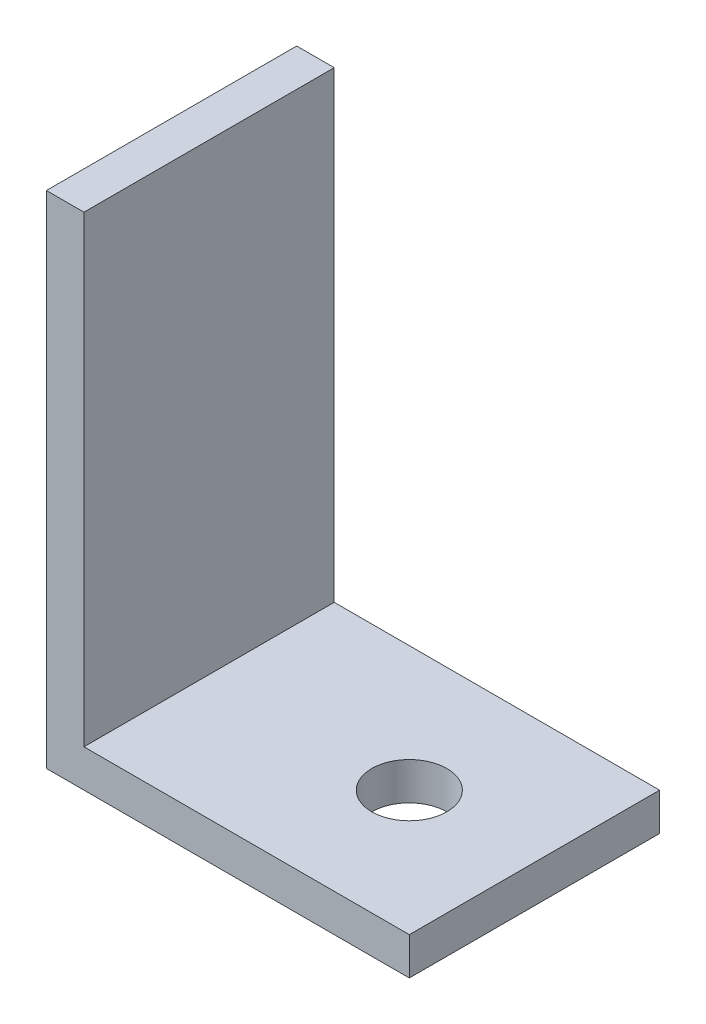
from build123d import *

# Parameters (mm, degrees)
BOSS_EXTRUDE1_DEPTH = 20
SKETCH2_R           = 3
CUT_EXTRUDE1_DEPTH  = 52.088159098


with BuildPart() as part:
    # Sketch1 → Boss-Extrude1 (new body)
    with BuildSketch(Plane.XY):
        Polygon((0, 0), (0, 40), (3, 40), (3, 3), (29, 3), (29, 0), align=None)
    extrude(amount=BOSS_EXTRUDE1_DEPTH)

    # Sketch2 → Cut-Extrude1 (cut, through all)
    with BuildSketch(Plane(origin=(0, 3, 0), x_dir=(1, 0, 0), z_dir=(0, 1, 0))):
        with Locations(Location((19, -10, 0), (0, 0, 180))):
            Circle(SKETCH2_R)
    extrude(amount=-CUT_EXTRUDE1_DEPTH, mode=Mode.SUBTRACT)


solid = part.part
